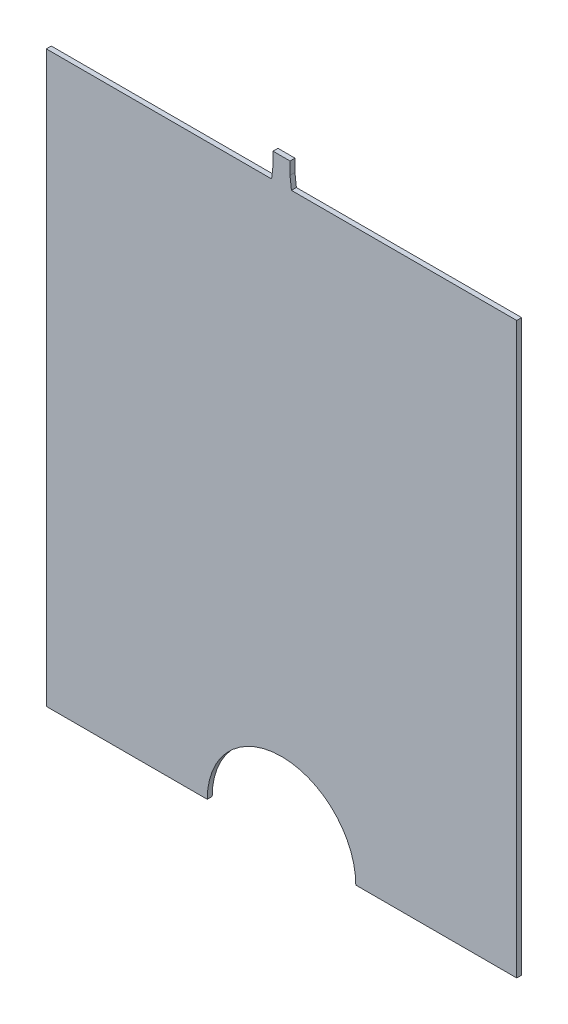
from build123d import *

# Parameters (mm, degrees)
BOSS_EXTRUDE1_DEPTH = 1


with BuildPart() as part:
    # Sketch2 → Boss-Extrude1 (new, symmetric)
    with BuildSketch(Plane.XY):
        with BuildLine():
            Line((30, 0), (95, 0))
            Line((95, 0), (95, 230))
            Line((95, 230), (4, 230))
            Line((4, 230), (3.430566833, 235))
            Line((3.430566833, 235), (3.430566833, 240))
            Line((3.430566833, 240), (-3.430566833, 240))
            Line((-3.430566833, 240), (-3.430566833, 235))
            Line((-3.430566833, 235), (-4, 230))
            Line((-4, 230), (-95, 230))
            Line((-95, 230), (-95, 0))
            Line((-95, 0), (-30, 0))
            ThreePointArc((-30, 0), (0, 30), (30, 0))
        make_face()
    extrude(amount=BOSS_EXTRUDE1_DEPTH, both=True)


solid = part.part
